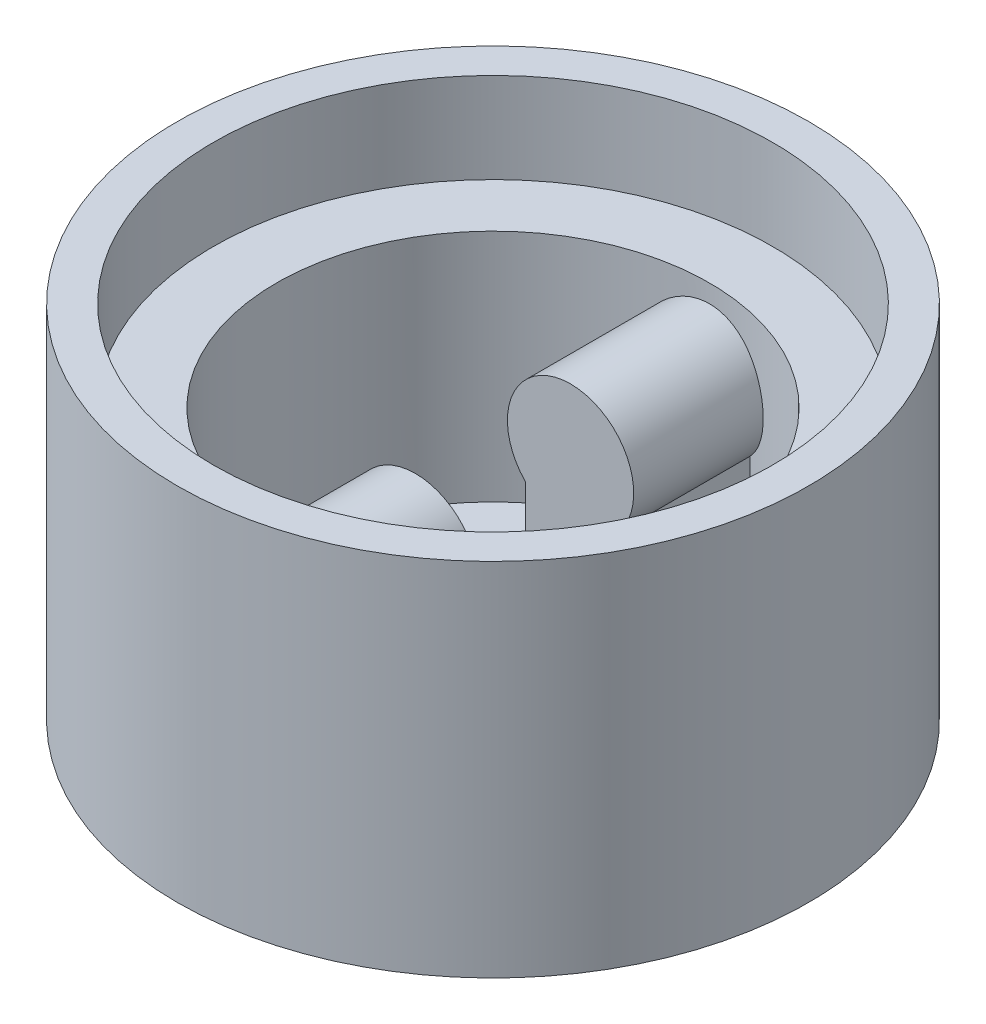
from build123d import *

# Parameters (mm, degrees)
SKETCH1_R                            = 17.5
BOSS_EXTRUDE1_DEPTH                  = 20
SKETCH2_R                            = 12
CUT_EXTRUDE1_DEPTH                   = 18
SKETCH2_3_R                          = 15.5
SKETCH2_3_R_2                        = 12
CUT_EXTRUDE2_DEPTH                   = 5
BOSS_EXTRUDE2_REACH                  = 33.82
BOSS_EXTRUDE2_END_RADIUS             = 12
BOSS_EXTRUDE2_DIRECTION_2_REACH      = 33.82
BOSS_EXTRUDE2_DIRECTION_2_END_RADIUS = 12
SKETCH5_W                            = 7
SKETCH5_H                            = 8.6
CUT_EXTRUDE3_DEPTH                   = 18
F_4_0MM_DOWEL_HOLE1_D                = 4
F_4_0MM_DOWEL_HOLE1_ON_FACE_2_D      = 4


with BuildPart() as part:
    # Sketch1 → Boss-Extrude1 (new body)
    with BuildSketch(Plane(origin=(0, 0, 0), x_dir=(1, 0, 0), z_dir=(0, 1, 0))):
        with Locations(Location((0, 0, 0), (0, 0, 270))):
            Circle(SKETCH1_R)
    extrude(amount=BOSS_EXTRUDE1_DEPTH)

    # Sketch2 → Cut-Extrude1 (cut)
    with BuildSketch(Plane(origin=(0, 20, 0), x_dir=(1, 0, 0), z_dir=(0, 1, 0))):
        with Locations(Location((0, 0, 0), (0, 0, 270))):
            Circle(SKETCH2_R)
    extrude(amount=-CUT_EXTRUDE1_DEPTH, mode=Mode.SUBTRACT)

    # Sketch2<3> → Cut-Extrude2 (cut)
    with BuildSketch(Plane(origin=(0, 20, 0), x_dir=(1, 0, 0), z_dir=(0, 1, 0))):
        with Locations(Location((0, 0, 0), (0, 0, 270))):
            Circle(SKETCH2_3_R)
        with Locations(Location((0, 0, 0), (0, 0, 270))):
            Circle(SKETCH2_3_R_2, mode=Mode.SUBTRACT)
    extrude(amount=-CUT_EXTRUDE2_DEPTH, mode=Mode.SUBTRACT)

    # Boss-Extrude2: up to this cylinder (the profile starts inside it)
    boss_extrude2_end = Plane(origin=(0, 8.116384, 0), z_dir=(0, 1, 0)) * Cylinder(BOSS_EXTRUDE2_END_RADIUS, 92.64, mode=Mode.PRIVATE)
    # Sketch3 → Boss-Extrude2 (add, up to the surface)
    with BuildSketch(Plane.XY, mode=Mode.PRIVATE) as boss_extrude2_sk1:
        with BuildLine():
            Line((-2.5, 8.050510257), (-2.5, 2))
            Line((-2.5, 2), (2.5, 2))
            Line((2.5, 2), (2.5, 8.050510257))
            ThreePointArc((2.5, 8.050510257), (0, 14), (-2.5, 8.050510257))
        make_face()
    boss_extrude2_tool1 = extrude(boss_extrude2_sk1.sketch, amount=BOSS_EXTRUDE2_REACH, mode=Mode.PRIVATE) & boss_extrude2_end
    add(boss_extrude2_tool1.solids().sort_by_distance((0, 8.116384, 0))[0])

    # Boss-Extrude2 direction 2: up to this cylinder (the profile starts inside it)
    boss_extrude2_direction_2_end = Plane(origin=(0, 8.116384, 0), z_dir=(0, 1, 0)) * Cylinder(BOSS_EXTRUDE2_DIRECTION_2_END_RADIUS, 92.64, mode=Mode.PRIVATE)
    # Sketch3 → Boss-Extrude2 direction 2 (add, up to the surface)
    with BuildSketch(Plane.XY, mode=Mode.PRIVATE) as boss_extrude2_direction_2_sk1:
        with BuildLine():
            Line((-2.5, 8.050510257), (-2.5, 2))
            Line((-2.5, 2), (2.5, 2))
            Line((2.5, 2), (2.5, 8.050510257))
            ThreePointArc((2.5, 8.050510257), (0, 14), (-2.5, 8.050510257))
        make_face()
    boss_extrude2_direction_2_tool1 = extrude(boss_extrude2_direction_2_sk1.sketch, amount=-BOSS_EXTRUDE2_DIRECTION_2_REACH, mode=Mode.PRIVATE) & boss_extrude2_direction_2_end
    add(boss_extrude2_direction_2_tool1.solids().sort_by_distance((0, 8.116384, 0))[0])

    # Sketch5 → Cut-Extrude3 (cut)
    with BuildSketch(Plane(origin=(0, 20, 0), x_dir=(1, 0, 0), z_dir=(0, 1, 0))):
        Rectangle(SKETCH5_W, SKETCH5_H)
    extrude(amount=-CUT_EXTRUDE3_DEPTH, mode=Mode.SUBTRACT)

    # Ø4.0mm Dowel Hole1 (through all)
    with Locations(Plane(origin=(0, 0, 0), x_dir=(0, 0, -1), z_dir=(0, -1, 0))):
        with Locations((0, 0)):
            Hole(F_4_0MM_DOWEL_HOLE1_D / 2)

    # Ø4.0mm Dowel Hole1 on face 2 (through all)
    with Locations(Plane.ZX.offset(2)):
        with Locations((0, 0)):
            Hole(F_4_0MM_DOWEL_HOLE1_ON_FACE_2_D / 2)


solid = part.part
